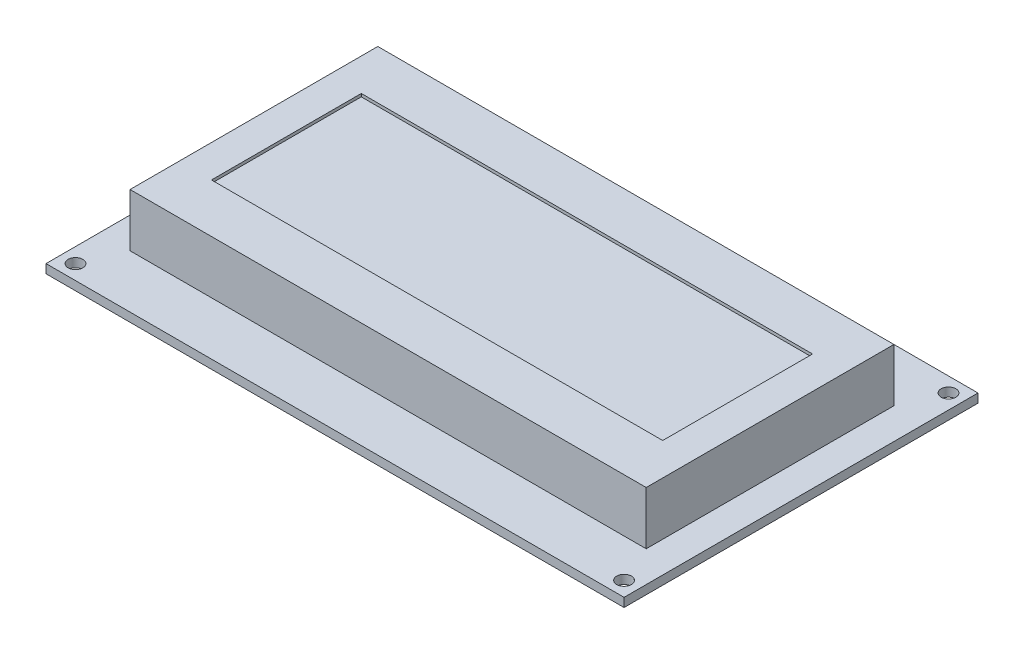
from build123d import *

# Parameters (mm, degrees)
SKETCH1_W           = 98
SKETCH1_H           = 60
BOSS_EXTRUDE1_DEPTH = 1.5
SKETCH2_W           = 87.5
SKETCH2_H           = 42
BOSS_EXTRUDE2_DEPTH = 9
SKETCH3_W           = 76.5
SKETCH3_H           = 25.4
CUT_EXTRUDE1_DEPTH  = 0.5
SKETCH4_R           = 1.25
CUT_EXTRUDE2_DEPTH  = 116.260574352
SKETCH5_R           = 0.5
CUT_EXTRUDE3_DEPTH  = 10
BOSS_EXTRUDE3_START = 0.1
SKETCH6_R           = 0.75
SKETCH6_R_2         = 0.5
SKETCH6_W           = 1.5
SKETCH6_H           = 1.5
BOSS_EXTRUDE3_DEPTH = 0.1
SKETCH7_R           = 0.75
SKETCH7_R_2         = 0.5
SKETCH7_W           = 1.5
SKETCH7_H           = 1.5
BOSS_EXTRUDE4_DEPTH = 1.7
BOSS_EXTRUDE5_DEPTH = 2.59


with BuildPart() as part:
    # Sketch1 → Boss-Extrude1 (new body)
    with BuildSketch(Plane(origin=(0, 0, 0), x_dir=(1, 0, 0), z_dir=(0, 1, 0))):
        with Locations((49, 30)):
            Rectangle(SKETCH1_W, SKETCH1_H)
    extrude(amount=BOSS_EXTRUDE1_DEPTH)

    # Sketch2 → Boss-Extrude2 (add)
    with BuildSketch(Plane(origin=(0, 1.5, 0), x_dir=(1, 0, 0), z_dir=(0, 1, 0))):
        with Locations((49, 30)):
            Rectangle(SKETCH2_W, SKETCH2_H)
    extrude(amount=BOSS_EXTRUDE2_DEPTH)

    # Sketch3 → Cut-Extrude1 (cut)
    with BuildSketch(Plane(origin=(0, 10.5, 0), x_dir=(1, 0, 0), z_dir=(0, 1, 0))):
        with Locations((49, 30)):
            Rectangle(SKETCH3_W, SKETCH3_H)
    extrude(amount=-CUT_EXTRUDE1_DEPTH, mode=Mode.SUBTRACT)

    # Sketch4 → Cut-Extrude2 (cut, through all)
    with BuildSketch(Plane(origin=(0, 1.5, 0), x_dir=(1, 0, 0), z_dir=(0, 1, 0))):
        with Locations(Location((2.5, 57.5, 0), (0, 0, 270))):
            Circle(SKETCH4_R)
        with Locations(Location((95.5, 57.5, 0), (0, 0, 270))):
            Circle(SKETCH4_R)
        with Locations(Location((95.5, 2.5, 0), (0, 0, 270))):
            Circle(SKETCH4_R)
        with Locations(Location((2.5, 2.5, 0), (0, 0, 270))):
            Circle(SKETCH4_R)
    extrude(amount=-CUT_EXTRUDE2_DEPTH, mode=Mode.SUBTRACT)

    # Sketch5 → Cut-Extrude3 (cut)
    with BuildSketch(Plane(origin=(0, 1.5, 0), x_dir=(1, 0, 0), z_dir=(0, 1, 0))):
        with Locations(Location((10, 57.5, 0), (0, 0, 270))):
            Circle(SKETCH5_R)
        with Locations(Location((12.54, 57.5, 0), (0, 0, 270))):
            Circle(SKETCH5_R)
        with Locations(Location((15.08, 57.5, 0), (0, 0, 270))):
            Circle(SKETCH5_R)
        with Locations(Location((20.16, 57.5, 0), (0, 0, 270))):
            Circle(SKETCH5_R)
        with Locations(Location((22.7, 57.5, 0), (0, 0, 270))):
            Circle(SKETCH5_R)
        with Locations(Location((25.24, 57.5, 0), (0, 0, 270))):
            Circle(SKETCH5_R)
        with Locations(Location((27.78, 57.5, 0), (0, 0, 270))):
            Circle(SKETCH5_R)
        with Locations(Location((30.32, 57.5, 0), (0, 0, 270))):
            Circle(SKETCH5_R)
        with Locations(Location((32.86, 57.5, 0), (0, 0, 270))):
            Circle(SKETCH5_R)
    extrude(amount=-CUT_EXTRUDE3_DEPTH, mode=Mode.SUBTRACT)

    # Sketch6 → Boss-Extrude3 (add)
    # profile 1 of 9: a face of its own
    with BuildSketch(Plane(origin=(0, 1.5, 0), x_dir=(1, 0, 0), z_dir=(0, 1, 0)).offset(BOSS_EXTRUDE3_START)):
        with Locations(Location((12.54, 57.5, 0), (0, 0, 90))):
            Circle(SKETCH6_R)
        with Locations(Location((12.54, 57.5, 0), (0, 0, 270))):
            Circle(SKETCH6_R_2, mode=Mode.SUBTRACT)
    # profile 2 of 9: a face of its own
    with BuildSketch(Plane(origin=(0, 1.5, 0), x_dir=(1, 0, 0), z_dir=(0, 1, 0)).offset(BOSS_EXTRUDE3_START)):
        with Locations(Location((15.08, 57.5, 0), (0, 0, 90))):
            Circle(SKETCH6_R)
        with Locations(Location((15.08, 57.5, 0), (0, 0, 270))):
            Circle(SKETCH6_R_2, mode=Mode.SUBTRACT)
    # profile 3 of 9: a face of its own
    with BuildSketch(Plane(origin=(0, 1.5, 0), x_dir=(1, 0, 0), z_dir=(0, 1, 0)).offset(BOSS_EXTRUDE3_START)):
        with Locations(Location((22.7, 57.5, 0), (0, 0, 90))):
            Circle(SKETCH6_R)
        with Locations(Location((22.7, 57.5, 0), (0, 0, 270))):
            Circle(SKETCH6_R_2, mode=Mode.SUBTRACT)
    # profile 4 of 9: a face of its own
    with BuildSketch(Plane(origin=(0, 1.5, 0), x_dir=(1, 0, 0), z_dir=(0, 1, 0)).offset(BOSS_EXTRUDE3_START)):
        with Locations(Location((25.24, 57.5, 0), (0, 0, 90))):
            Circle(SKETCH6_R)
        with Locations(Location((25.24, 57.5, 0), (0, 0, 270))):
            Circle(SKETCH6_R_2, mode=Mode.SUBTRACT)
    # profile 5 of 9: a face of its own
    with BuildSketch(Plane(origin=(0, 1.5, 0), x_dir=(1, 0, 0), z_dir=(0, 1, 0)).offset(BOSS_EXTRUDE3_START)):
        with Locations(Location((27.78, 57.5, 0), (0, 0, 90))):
            Circle(SKETCH6_R)
        with Locations(Location((27.78, 57.5, 0), (0, 0, 270))):
            Circle(SKETCH6_R_2, mode=Mode.SUBTRACT)
    # profile 6 of 9: a face of its own
    with BuildSketch(Plane(origin=(0, 1.5, 0), x_dir=(1, 0, 0), z_dir=(0, 1, 0)).offset(BOSS_EXTRUDE3_START)):
        with Locations(Location((30.32, 57.5, 0), (0, 0, 90))):
            Circle(SKETCH6_R)
        with Locations(Location((30.32, 57.5, 0), (0, 0, 270))):
            Circle(SKETCH6_R_2, mode=Mode.SUBTRACT)
    # profile 7 of 9: a face of its own
    with BuildSketch(Plane(origin=(0, 1.5, 0), x_dir=(1, 0, 0), z_dir=(0, 1, 0)).offset(BOSS_EXTRUDE3_START)):
        with Locations(Location((32.86, 57.5, 0), (0, 0, 90))):
            Circle(SKETCH6_R)
        with Locations(Location((32.86, 57.5, 0), (0, 0, 270))):
            Circle(SKETCH6_R_2, mode=Mode.SUBTRACT)
    # profile 8 of 9: a face of its own
    with BuildSketch(Plane(origin=(0, 1.5, 0), x_dir=(1, 0, 0), z_dir=(0, 1, 0)).offset(BOSS_EXTRUDE3_START)):
        with Locations((20.16, 57.5)):
            Rectangle(SKETCH6_W, SKETCH6_H)
        with Locations(Location((20.16, 57.5, 0), (0, 0, 270))):
            Circle(SKETCH6_R_2, mode=Mode.SUBTRACT)
    # profile 9 of 9: a face of its own
    with BuildSketch(Plane(origin=(0, 1.5, 0), x_dir=(1, 0, 0), z_dir=(0, 1, 0)).offset(BOSS_EXTRUDE3_START)):
        with Locations((10, 57.5)):
            Rectangle(SKETCH6_W, SKETCH6_H)
        with Locations(Location((10, 57.5, 0), (0, 0, 270))):
            Circle(SKETCH6_R_2, mode=Mode.SUBTRACT)
    extrude(amount=-BOSS_EXTRUDE3_DEPTH)

    # Sketch7 → Boss-Extrude4 (add)
    # profile 1 of 9: a face of its own
    with BuildSketch(Plane(origin=(0, 1.6, 0), x_dir=(1, 0, 0), z_dir=(0, 1, 0))):
        with Locations(Location((12.54, 57.5, 0), (0, 0, 90))):
            Circle(SKETCH7_R)
        with Locations(Location((12.54, 57.5, 0), (0, 0, 270))):
            Circle(SKETCH7_R_2, mode=Mode.SUBTRACT)
    # profile 2 of 9: a face of its own
    with BuildSketch(Plane(origin=(0, 1.6, 0), x_dir=(1, 0, 0), z_dir=(0, 1, 0))):
        with Locations(Location((15.08, 57.5, 0), (0, 0, 90))):
            Circle(SKETCH7_R)
        with Locations(Location((15.08, 57.5, 0), (0, 0, 270))):
            Circle(SKETCH7_R_2, mode=Mode.SUBTRACT)
    # profile 3 of 9: a face of its own
    with BuildSketch(Plane(origin=(0, 1.6, 0), x_dir=(1, 0, 0), z_dir=(0, 1, 0))):
        with Locations(Location((22.7, 57.5, 0), (0, 0, 90))):
            Circle(SKETCH7_R)
        with Locations(Location((22.7, 57.5, 0), (0, 0, 270))):
            Circle(SKETCH7_R_2, mode=Mode.SUBTRACT)
    # profile 4 of 9: a face of its own
    with BuildSketch(Plane(origin=(0, 1.6, 0), x_dir=(1, 0, 0), z_dir=(0, 1, 0))):
        with Locations(Location((25.24, 57.5, 0), (0, 0, 90))):
            Circle(SKETCH7_R)
        with Locations(Location((25.24, 57.5, 0), (0, 0, 270))):
            Circle(SKETCH7_R_2, mode=Mode.SUBTRACT)
    # profile 5 of 9: a face of its own
    with BuildSketch(Plane(origin=(0, 1.6, 0), x_dir=(1, 0, 0), z_dir=(0, 1, 0))):
        with Locations(Location((27.78, 57.5, 0), (0, 0, 90))):
            Circle(SKETCH7_R)
        with Locations(Location((27.78, 57.5, 0), (0, 0, 270))):
            Circle(SKETCH7_R_2, mode=Mode.SUBTRACT)
    # profile 6 of 9: a face of its own
    with BuildSketch(Plane(origin=(0, 1.6, 0), x_dir=(1, 0, 0), z_dir=(0, 1, 0))):
        with Locations(Location((30.32, 57.5, 0), (0, 0, 90))):
            Circle(SKETCH7_R)
        with Locations(Location((30.32, 57.5, 0), (0, 0, 270))):
            Circle(SKETCH7_R_2, mode=Mode.SUBTRACT)
    # profile 7 of 9: a face of its own
    with BuildSketch(Plane(origin=(0, 1.6, 0), x_dir=(1, 0, 0), z_dir=(0, 1, 0))):
        with Locations(Location((32.86, 57.5, 0), (0, 0, 90))):
            Circle(SKETCH7_R)
        with Locations(Location((32.86, 57.5, 0), (0, 0, 270))):
            Circle(SKETCH7_R_2, mode=Mode.SUBTRACT)
    # profile 8 of 9: a face of its own
    with BuildSketch(Plane(origin=(0, 1.6, 0), x_dir=(1, 0, 0), z_dir=(0, 1, 0))):
        with Locations((10, 57.5)):
            Rectangle(SKETCH7_W, SKETCH7_H)
        with Locations(Location((10, 57.5, 0), (0, 0, 270))):
            Circle(SKETCH7_R_2, mode=Mode.SUBTRACT)
    # profile 9 of 9: a face of its own
    with BuildSketch(Plane(origin=(0, 1.6, 0), x_dir=(1, 0, 0), z_dir=(0, 1, 0))):
        with Locations((20.16, 57.5)):
            Rectangle(SKETCH7_W, SKETCH7_H)
        with Locations(Location((20.16, 57.5, 0), (0, 0, 270))):
            Circle(SKETCH7_R_2, mode=Mode.SUBTRACT)
    extrude(amount=-BOSS_EXTRUDE4_DEPTH)

    # Sketch8 → Boss-Extrude5 (add)
    with BuildSketch(Plane.XZ):
        Polygon((5.25, -9), (5.25, -12), (5.75, -12), (5.75, -9.5), (8.25, -9.5), (8.25, -9), align=None)
        Polygon((92.25, -12), (92.75, -12), (92.75, -9), (89.75, -9), (89.75, -9.5), (92.25, -9.5), align=None)
        Polygon((92.75, -51), (92.75, -48), (92.25, -48), (92.25, -50.5), (89.75, -50.5), (89.75, -51), align=None)
        Polygon((5.75, -48), (5.25, -48), (5.25, -51), (8.25, -51), (8.25, -50.5), (5.75, -50.5), align=None)
    extrude(amount=BOSS_EXTRUDE5_DEPTH)


solid = part.part
